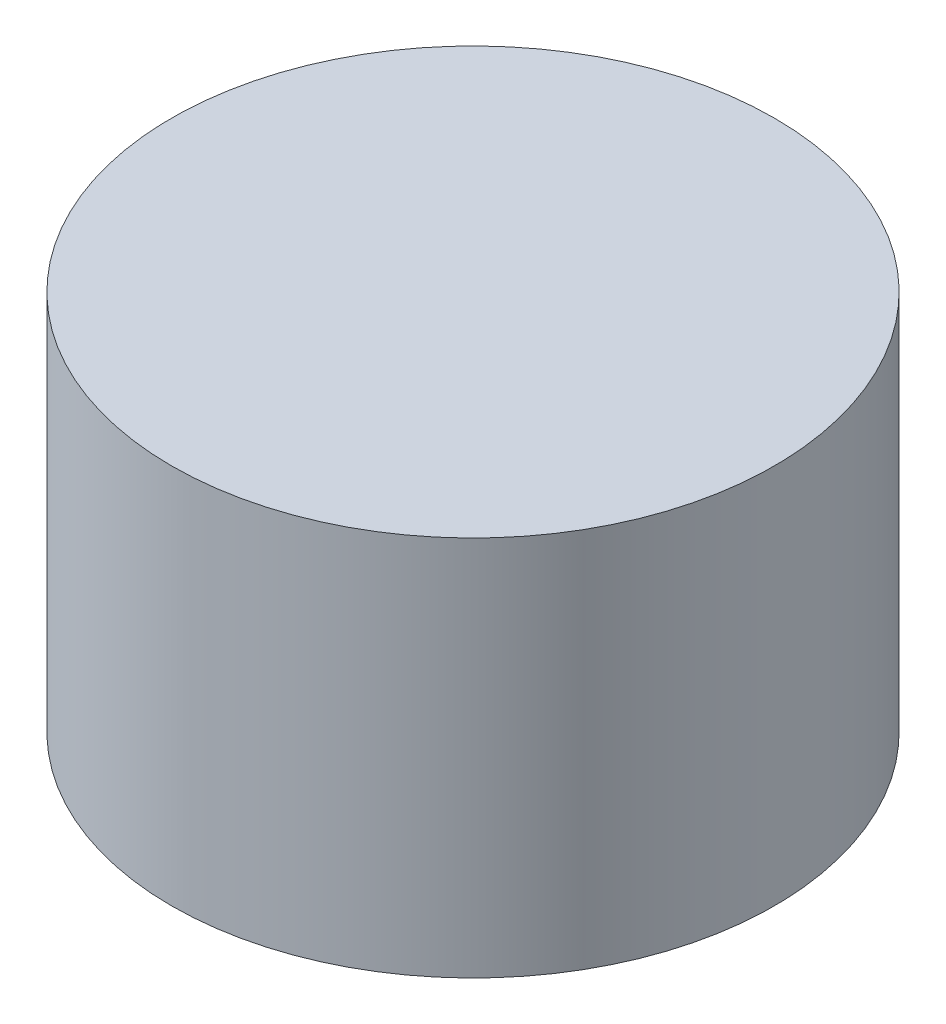
from build123d import *

# Parameters (mm, degrees)
SKETCH1_R           = 111.5
BOSS_EXTRUDE1_DEPTH = 141


with BuildPart() as part:
    # Sketch1 → Boss-Extrude1 (new body)
    with BuildSketch(Plane(origin=(0, 0, 0), x_dir=(1, 0, 0), z_dir=(0, 1, 0))):
        with Locations(Location((0, 0, 0), (0, 0, 270))):
            Circle(SKETCH1_R)
    extrude(amount=BOSS_EXTRUDE1_DEPTH)


solid = part.part
